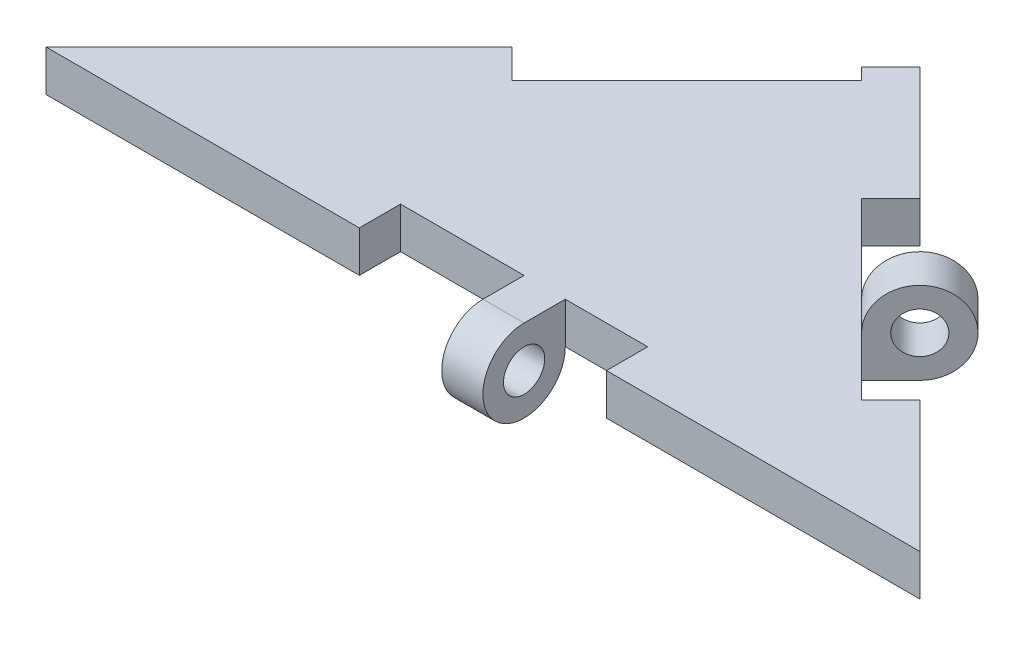
from build123d import *

# Parameters (mm, degrees)
BOSS_EXTRUDE1_DEPTH = 5
SKETCH2_W           = 30
SKETCH2_H           = 5
CUT_EXTRUDE1_DEPTH  = 5
CUT_EXTRUDE2_DEPTH  = 5
BOSS_EXTRUDE2_START = 10
SKETCH5_R           = 2.5
BOSS_EXTRUDE2_DEPTH = 5
BOSS_EXTRUDE3_START = 10
SKETCH6_R           = 2.5
BOSS_EXTRUDE3_DEPTH = 5
CUT_EXTRUDE3_DEPTH  = 10


with BuildPart() as part:
    # Sketch1 → Boss-Extrude1 (new body)
    with BuildSketch(Plane(origin=(0, 0, 0), x_dir=(1, 0, 0), z_dir=(0, 1, 0))):
        Polygon((-53.033008589, 0), (53.033008589, 0), (0, 53.033008589), align=None)
    extrude(amount=BOSS_EXTRUDE1_DEPTH)

    # Sketch2 → Cut-Extrude1 (cut)
    with BuildSketch(Plane(origin=(0, 5, 0), x_dir=(1, 0, 0), z_dir=(0, 1, 0))):
        with Locations((0, 2.5)):
            Rectangle(SKETCH2_W, SKETCH2_H)
        Polygon((-3.535533906, 49.497474683), (-24.748737342, 28.284271247), (-21.213203436, 24.748737342), (0, 45.961940777), align=None)
    extrude(amount=-CUT_EXTRUDE1_DEPTH, mode=Mode.SUBTRACT)

    # Sketch3 → Cut-Extrude2 (cut)
    with BuildSketch(Plane.XZ):
        Polygon((15.909902577, -37.123106012), (37.123106012, -15.909902577), (33.587572106, -12.374368671), (12.374368671, -33.587572106), align=None)
    extrude(amount=-CUT_EXTRUDE2_DEPTH, mode=Mode.SUBTRACT)

    # Sketch5 → Boss-Extrude2 (add)
    with BuildSketch(Plane.ZY.offset(-15).offset(BOSS_EXTRUDE2_START)):
        with BuildLine():
            Line((0, 5), (-5, 5))
            Line((-5, 5), (-5, 0))
            ThreePointArc((-5, 0), (3.535533906, -3.535533906), (0, 5))
        make_face()
        Circle(SKETCH5_R, mode=Mode.SUBTRACT)
    extrude(amount=BOSS_EXTRUDE2_DEPTH)

    # Sketch6 → Boss-Extrude3 (add)
    with BuildSketch(Plane(origin=(10.606601718, 0, 10.606601718), x_dir=(-0.7071067811865478, 0, 0.7071067811865472), z_dir=(-0.7071067811865472, 0, -0.7071067811865478)).offset(BOSS_EXTRUDE3_START)):
        with BuildLine():
            ThreePointArc((-32.5, 5), (-41.035533906, 8.535533906), (-37.5, 0))
            Line((-37.5, 0), (-32.5, 0))
            Line((-32.5, 0), (-32.5, 5))
        make_face()
        with Locations((-37.5, 5)):
            Circle(SKETCH6_R, mode=Mode.SUBTRACT)
    extrude(amount=BOSS_EXTRUDE3_DEPTH)

    # Sketch7 → Cut-Extrude3 (cut)
    with BuildSketch(Plane(origin=(0, 5, 0), x_dir=(1, 0, 0), z_dir=(0, 1, 0))):
        Polygon((-20.115925926, 32.917082663), (0, 53.033008589), (2.121320344, 50.911688245), (-17.994605582, 30.79576232), align=None)
    extrude(amount=-CUT_EXTRUDE3_DEPTH, mode=Mode.SUBTRACT)


solid = part.part
